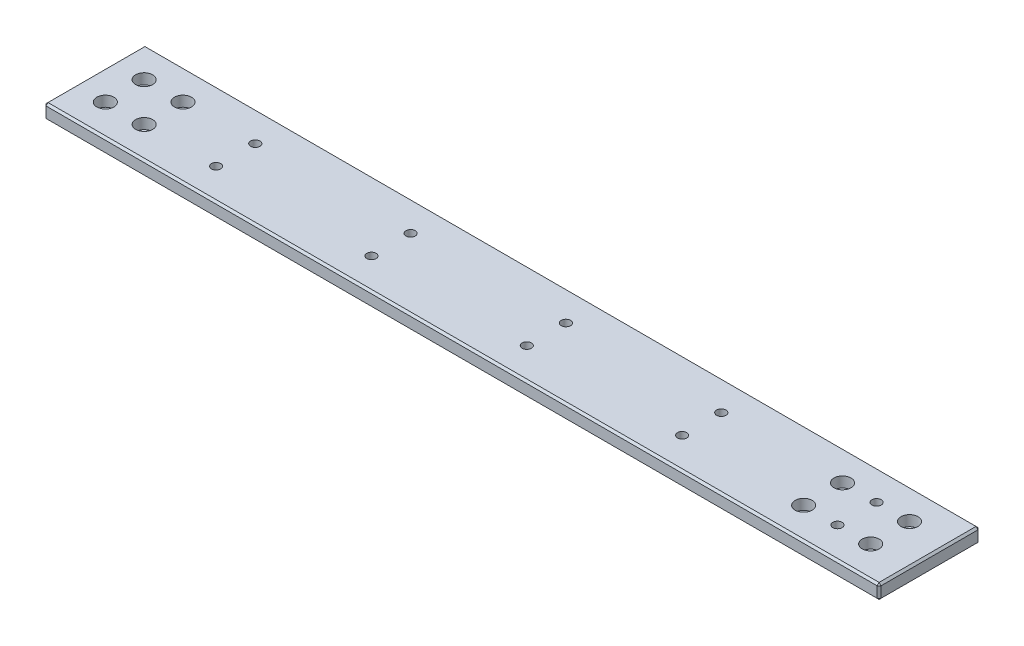
from build123d import *

# Parameters (mm, degrees)
SKETCH1_W                       = 538
SKETCH1_H                       = 65
EXTRUDE1_DEPTH                  = 9.525
M6X1_0_TAPPED_HOLE1_D           = 5
M6X1_0_TAPPED_HOLE1_DEPTH       = 16.9926
M6X1_0_TAPPED_HOLE1_CBORE_D     = 6
M6X1_0_TAPPED_HOLE1_CBORE_DEPTH = 11.9888
M6X1_0_TAPPED_HOLE1_TIP         = 1.502151548
CBORE_FOR_M6_SHCS1_D            = 6.6
CBORE_FOR_M6_SHCS1_CBORE_D      = 11
CBORE_FOR_M6_SHCS1_CBORE_DEPTH  = 6.762
CHAMFER1_SIZE                   = 1.27


with BuildPart() as part:
    # Sketch1 → Extrude1 (new body)
    with BuildSketch(Plane(origin=(0, 0, 0), x_dir=(1, 0, 0), z_dir=(0, 1, 0))):
        Rectangle(SKETCH1_W, SKETCH1_H)
    extrude(amount=-EXTRUDE1_DEPTH)

    # M6x1.0 Tapped Hole1
    with Locations(Plane(origin=(0, 0, 0), x_dir=(-1, 0, 0), z_dir=(0, 1, 0))):
        with Locations((178.004380433, 12.6), (178.004380433, -12.6), (77.928380433, 12.6), (77.928380433, -12.6), (-22.147619567, 12.6), (-22.147619567, -12.6), (-122.223619567, 12.6), (-122.223619567, -12.6), (-222.299619567, 12.6), (-222.299619567, -12.6)):
            CounterBoreHole(M6X1_0_TAPPED_HOLE1_D / 2, M6X1_0_TAPPED_HOLE1_CBORE_D / 2, M6X1_0_TAPPED_HOLE1_CBORE_DEPTH, depth=M6X1_0_TAPPED_HOLE1_DEPTH)
            with Locations((0, 0, -(M6X1_0_TAPPED_HOLE1_DEPTH + M6X1_0_TAPPED_HOLE1_TIP / 2))):  # 118° drill point
                Cone(0, M6X1_0_TAPPED_HOLE1_D / 2, M6X1_0_TAPPED_HOLE1_TIP, mode=Mode.SUBTRACT)

    # CBORE for M6 SHCS1 (through all)
    with Locations(Plane(origin=(0, 0, 0), x_dir=(-1, 0, 0), z_dir=(0, 1, 0))):
        with Locations((249.493618693, 12.5), (224.493618693, 12.5), (224.493618693, -12.5), (249.493618693, -12.5), (-243.6, 12.5), (-200.42, 12.5), (-243.6, -12.5), (-200.42, -12.5)):
            CounterBoreHole(CBORE_FOR_M6_SHCS1_D / 2, CBORE_FOR_M6_SHCS1_CBORE_D / 2, CBORE_FOR_M6_SHCS1_CBORE_DEPTH)

    # Chamfer1
    chamfer1_edges = [part.edges().sort_by_distance(p)[0] for p in [
        (-269, -4.7625, -32.5),
        (-269, -4.7625, 32.5),
        (-269, 0, 0),
        (0, 0, 32.5),
        (0, 0, -32.5),
        (269, 0, 0),
        (269, -4.7625, 32.5),
        (269, -4.7625, -32.5),
        (0, -9.525, 32.5),
        (-269, -9.525, 0),
        (0, -9.525, -32.5),
        (269, -9.525, 0),
    ]]
    chamfer(chamfer1_edges, length=CHAMFER1_SIZE)


solid = part.part
